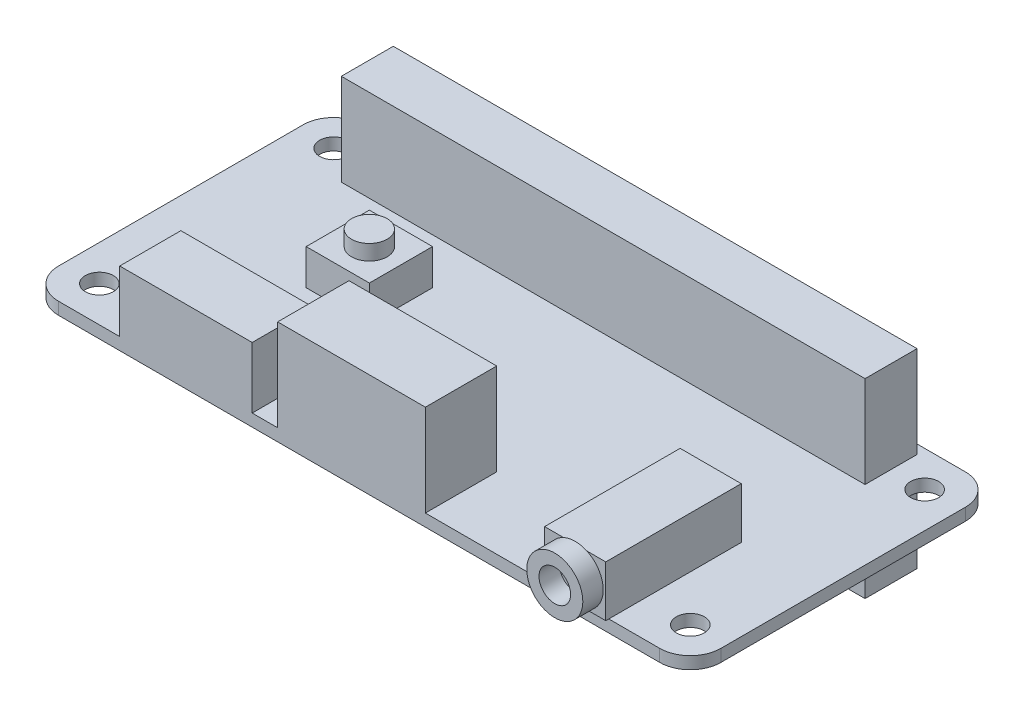
from build123d import *

# Parameters (mm, degrees)
EXTRUDE_1_DEPTH     = 1.2
SKETCH_2_R          = 1.375
CUT_EXTRUDE_1_DEPTH = 1.2
SKETCH_3_W          = 6
SKETCH_3_H          = 13
EXTRUDE_2_DEPTH     = 5
SKETCH_4_W          = 6
SKETCH_4_H          = 5
EXTRUDE_3_DEPTH     = 0.3
SKETCH_5_W          = 14.5
SKETCH_5_H          = 7
EXTRUDE_4_DEPTH     = 9
SKETCH_6_W          = 13
SKETCH_6_H          = 6
EXTRUDE_5_DEPTH     = 6
SKETCH_11_W         = 51.4
SKETCH_11_H         = 5.1
EXTRUDE_9_DEPTH     = 8.5
SKETCH_12_W         = 6.2
SKETCH_12_H         = 6.2
EXTRUDE_10_DEPTH    = 3.5
SKETCH_13_R         = 1.75
EXTRUDE_11_DEPTH    = 1.5
SKETCH_15_R         = 2.75
SKETCH_15_R_2       = 1.55
EXTRUDE_13_DEPTH    = 2
SKETCH_16_W         = 51.4
SKETCH_16_H         = 5.1
EXTRUDE_14_DEPTH    = 9


with BuildPart() as part:
    # 草图1 → 凸台-拉伸1 (new body)
    with BuildSketch(Plane(origin=(0, 0, 0), x_dir=(1, 0, 0), z_dir=(0, 1, 0))):
        with BuildLine():
            Line((-29.5, 15), (29.5, 15))
            ThreePointArc((29.5, 15), (31.621320344, 14.121320344), (32.5, 12))
            Line((32.5, 12), (32.5, -12))
            ThreePointArc((32.5, -12), (31.621320344, -14.121320344), (29.5, -15))
            Line((29.5, -15), (-29.5, -15))
            ThreePointArc((-29.5, -15), (-31.621320344, -14.121320344), (-32.5, -12))
            Line((-32.5, -12), (-32.5, 12))
            ThreePointArc((-32.5, 12), (-31.621320344, 14.121320344), (-29.5, 15))
        make_face()
    extrude(amount=EXTRUDE_1_DEPTH)

    # 草图2 → 切除-拉伸1 (cut)
    with BuildSketch(Plane(origin=(0, 1.2, 0), x_dir=(1, 0, 0), z_dir=(0, 1, 0))):
        with Locations(Location((29, -11.5, 0), (0, 0, 270))):
            Circle(SKETCH_2_R)
        with Locations(Location((29, 11.5, 0), (0, 0, 270))):
            Circle(SKETCH_2_R)
        with Locations(Location((-29, -11.5, 0), (0, 0, 270))):
            Circle(SKETCH_2_R)
        with Locations(Location((-29, 11.5, 0), (0, 0, 270))):
            Circle(SKETCH_2_R)
    extrude(amount=-CUT_EXTRUDE_1_DEPTH, mode=Mode.SUBTRACT)

    # 草图3 → 凸台-拉伸2 (add)
    with BuildSketch(Plane(origin=(0, 1.2, 0), x_dir=(1, 0, 0), z_dir=(0, 1, 0))):
        with Locations((21.5, -8.5)):
            Rectangle(SKETCH_3_W, SKETCH_3_H)
    extrude(amount=EXTRUDE_2_DEPTH)

    # 草图4 → 凸台-拉伸3 (add)
    with BuildSketch(Plane.XY.offset(15)):
        with Locations((21.5, 3.7)):
            Rectangle(SKETCH_4_W, SKETCH_4_H)
    extrude(amount=EXTRUDE_3_DEPTH)

    # 草图5 → 凸台-拉伸4 (add)
    with BuildSketch(Plane(origin=(0, 1.2, 0), x_dir=(1, 0, 0), z_dir=(0, 1, 0))):
        with Locations((-0.75, -11.5)):
            Rectangle(SKETCH_5_W, SKETCH_5_H)
    extrude(amount=EXTRUDE_4_DEPTH)

    # 草图6 → 凸台-拉伸5 (add)
    with BuildSketch(Plane(origin=(0, 1.2, 0), x_dir=(1, 0, 0), z_dir=(0, 1, 0))):
        with Locations((-17, -12)):
            Rectangle(SKETCH_6_W, SKETCH_6_H)
    extrude(amount=EXTRUDE_5_DEPTH)

    # 草图11 → 凸台-拉伸9 (add)
    with BuildSketch(Plane.XZ):
        with Locations((-0.05, -11.55)):
            Rectangle(SKETCH_11_W, SKETCH_11_H)
    extrude(amount=EXTRUDE_9_DEPTH)

    # 草图12 → 凸台-拉伸10 (add)
    with BuildSketch(Plane(origin=(0, 1.2, 0), x_dir=(1, 0, 0), z_dir=(0, 1, 0))):
        with Locations((-15.4, 1.4)):
            Rectangle(SKETCH_12_W, SKETCH_12_H)
    extrude(amount=EXTRUDE_10_DEPTH)

    # 草图13 → 凸台-拉伸11 (add)
    with BuildSketch(Plane(origin=(0, 4.7, 0), x_dir=(1, 0, 0), z_dir=(0, 1, 0))):
        with Locations(Location((-15.4, 1.4, 0), (0, 0, 270))):
            Circle(SKETCH_13_R)
    extrude(amount=EXTRUDE_11_DEPTH)

    # 草图15 → 凸台-拉伸13 (add)
    with BuildSketch(Plane.XY.offset(15.3)):
        with Locations(Location((21.5, 3.7, 0), (0, 0, 114.619977329))):
            Circle(SKETCH_15_R)
        with Locations((21.5, 3.7)):
            Circle(SKETCH_15_R_2, mode=Mode.SUBTRACT)
    extrude(amount=EXTRUDE_13_DEPTH)

    # 草图16 → 凸台-拉伸14 (add)
    with BuildSketch(Plane(origin=(0, 1.2, 0), x_dir=(1, 0, 0), z_dir=(0, 1, 0))):
        with Locations((-0.05, 11.55)):
            Rectangle(SKETCH_16_W, SKETCH_16_H)
    extrude(amount=EXTRUDE_14_DEPTH)


solid = part.part
